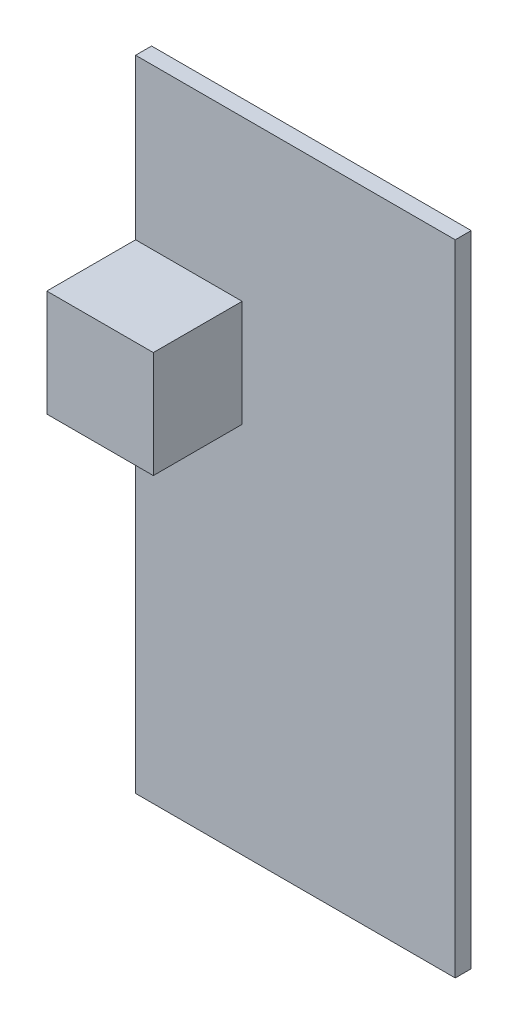
from build123d import *

# Parameters (mm, degrees)
CROQUIS1_W              = 18
CROQUIS1_H              = 36
SALIENTE_EXTRUIR1_DEPTH = 0.9
CROQUIS2_W              = 6
CROQUIS2_H              = 6
SALIENTE_EXTRUIR2_DEPTH = 5


with BuildPart() as part:
    # Croquis1 → Saliente-Extruir1 (new body)
    with BuildSketch(Plane.XY):
        with Locations((3.153152256, -14.229050279)):
            Rectangle(CROQUIS1_W, CROQUIS1_H)
    extrude(amount=SALIENTE_EXTRUIR1_DEPTH)

    # Croquis2 → Saliente-Extruir2 (add)
    with BuildSketch(Plane.XY.offset(0.9)):
        with Locations((-2.846847744, -8.229050279)):
            Rectangle(CROQUIS2_W, CROQUIS2_H)
    extrude(amount=SALIENTE_EXTRUIR2_DEPTH)


solid = part.part
